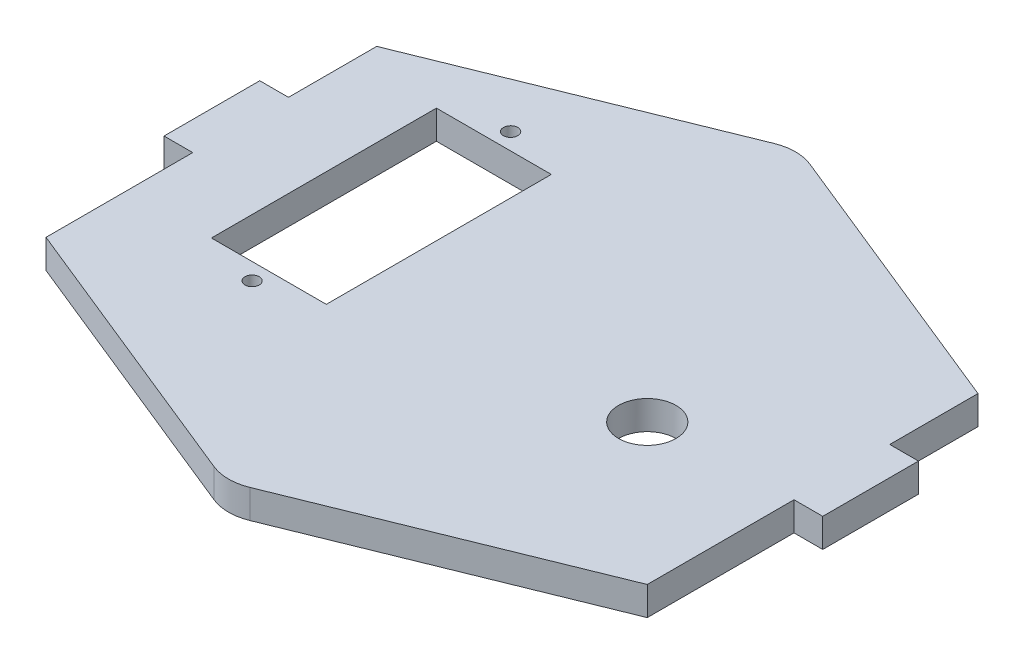
from build123d import *

# Parameters (mm, degrees)
BOSS_EXTRUDE4_DEPTH      = 3
SKETCH8_W                = 3
SKETCH8_H                = 8
SKETCH8_H_2              = 14.11
CUT_EXTRUDE5_DEPTH       = 3
SKETCH9_R                = 0.75
SKETCH9_W                = 12
SKETCH9_H                = 23.5
CUT_EXTRUDE6_DEPTH       = 3
FILLET2_R                = 5
SPLIT1_SURFACE_1_1_BACK  = 91.82
SPLIT1_SURFACE_1_1_DEPTH = 183.64
SPLIT1_SURFACE_1_2_BACK  = 91.82
SPLIT1_SURFACE_1_2_DEPTH = 183.64
SPLIT1_SURFACE_2_3_BACK  = 91.82
SPLIT1_SURFACE_2_3_DEPTH = 183.64
SPLIT1_SURFACE_2_4_BACK  = 91.82
SPLIT1_SURFACE_2_4_DEPTH = 183.64
SPLIT1_SURFACE_3_5_BACK  = 91.82
SPLIT1_SURFACE_3_5_DEPTH = 183.64
SPLIT1_SURFACE_3_6_BACK  = 91.82
SPLIT1_SURFACE_3_6_DEPTH = 183.64
SPLIT1_SURFACE_4_7_BACK  = 91.82
SPLIT1_SURFACE_4_7_DEPTH = 183.64
SPLIT1_SURFACE_4_8_BACK  = 91.82
SPLIT1_SURFACE_4_8_DEPTH = 183.64
SKETCH11_R               = 3
CUT_EXTRUDE7_DEPTH       = 10


with BuildPart() as part:
    # Sketch6 → Boss-Extrude4 (new body)
    with BuildSketch(Plane(origin=(0, 0, 0), x_dir=(1, 0, 0), z_dir=(0, 1, 0))):
        Polygon((-34.4, 16.055), (0, 30), (34.4, 16.055), (34.4, -16.055), (0, -30), (-34.4, -16.055), align=None)
    extrude(amount=BOSS_EXTRUDE4_DEPTH)

    # Sketch8 → Cut-Extrude5 (cut)
    with BuildSketch(Plane(origin=(0, 3, 0), x_dir=(1, 0, 0), z_dir=(0, 1, 0))):
        with Locations((32.9, 12.055)):
            Rectangle(SKETCH8_W, SKETCH8_H)
        with Locations((32.9, -9)):
            Rectangle(SKETCH8_W, SKETCH8_H_2)
        with Locations((-32.9, -9)):
            Rectangle(SKETCH8_W, SKETCH8_H_2)
        with Locations((-32.9, 12.055)):
            Rectangle(SKETCH8_W, SKETCH8_H)
    extrude(amount=-CUT_EXTRUDE5_DEPTH, mode=Mode.SUBTRACT)

    # Sketch9 → Cut-Extrude6 (cut)
    with BuildSketch(Plane(origin=(0, 3, 0), x_dir=(1, 0, 0), z_dir=(0, 1, 0))):
        with Locations(Location((-16.7, 16.555, 0), (0, 0, 270))):
            Circle(SKETCH9_R)
        with Locations(Location((-16.7, -10.445, 0), (0, 0, 90))):
            Circle(SKETCH9_R)
        with Locations((-16.7, 3.055)):
            Rectangle(SKETCH9_W, SKETCH9_H)
    extrude(amount=-CUT_EXTRUDE6_DEPTH, mode=Mode.SUBTRACT)

    # Fillet2
    fillet2_edges = [part.edges().sort_by_distance(p)[0] for p in [
        (0, 1.5, -30),
        (0, 1.5, 30),
    ]]
    fillet(fillet2_edges, radius=FILLET2_R)


with BuildPart() as body_2:
    # Split1: the piece behind the surface
    add(part.part)
    # Split1 surface 1: a surface, the sketch's curves swept straight by 183.64 mm
    with BuildLine(Plane(origin=(0, 3, 0), x_dir=(1, 0, 0), z_dir=(0, 1, 0)).offset(-SPLIT1_SURFACE_1_1_BACK), mode=Mode.PRIVATE) as split1_surface_1_1_path:
        Line((34.4, 16.055), (31.4, 16.055))
        Line((31.4, 16.055), (31.4, 17.271133721))
        Line((31.4, 17.271133721), (34.4, 16.055))
    split1_surface_1_1 = Shell.extrude(split1_surface_1_1_path.wire(), (0 * SPLIT1_SURFACE_1_1_DEPTH, 1 * SPLIT1_SURFACE_1_1_DEPTH, 0 * SPLIT1_SURFACE_1_1_DEPTH))
    split(bisect_by=split1_surface_1_1, keep=Keep.BOTTOM)


with BuildPart() as part_1:
    add(part.part)

    # Split1: split by a surface, the side it looks to stays
    # Split1 surface 1: a surface, the sketch's curves swept straight by 183.64 mm
    with BuildLine(Plane(origin=(0, 3, 0), x_dir=(1, 0, 0), z_dir=(0, 1, 0)).offset(-SPLIT1_SURFACE_1_2_BACK), mode=Mode.PRIVATE) as split1_surface_1_2_path:
        Line((34.4, 16.055), (31.4, 16.055))
        Line((31.4, 16.055), (31.4, 17.271133721))
        Line((31.4, 17.271133721), (34.4, 16.055))
    split1_surface_1_2 = Shell.extrude(split1_surface_1_2_path.wire(), (0 * SPLIT1_SURFACE_1_2_DEPTH, 1 * SPLIT1_SURFACE_1_2_DEPTH, 0 * SPLIT1_SURFACE_1_2_DEPTH))
    split(bisect_by=split1_surface_1_2, keep=Keep.TOP)


with BuildPart() as body_3:
    # Split1 2: the piece behind the surface
    add(part_1.part)
    # Split1 surface 2: a surface, the sketch's curves swept straight by 183.64 mm
    with BuildLine(Plane(origin=(0, 3, 0), x_dir=(1, 0, 0), z_dir=(0, 1, 0)).offset(-SPLIT1_SURFACE_2_3_BACK), mode=Mode.PRIVATE) as split1_surface_2_3_path:
        Line((31.4, -17.271133721), (31.4, -16.055))
        Line((31.4, -16.055), (34.4, -16.055))
        Line((34.4, -16.055), (31.4, -17.271133721))
    split1_surface_2_3 = Shell.extrude(split1_surface_2_3_path.wire(), (0 * SPLIT1_SURFACE_2_3_DEPTH, 1 * SPLIT1_SURFACE_2_3_DEPTH, 0 * SPLIT1_SURFACE_2_3_DEPTH))
    split(bisect_by=split1_surface_2_3, keep=Keep.BOTTOM)


with BuildPart() as part_2:
    add(part_1.part)

    # Split1 2: split by a surface, the side it looks to stays
    # Split1 surface 2: a surface, the sketch's curves swept straight by 183.64 mm
    with BuildLine(Plane(origin=(0, 3, 0), x_dir=(1, 0, 0), z_dir=(0, 1, 0)).offset(-SPLIT1_SURFACE_2_4_BACK), mode=Mode.PRIVATE) as split1_surface_2_4_path:
        Line((31.4, -17.271133721), (31.4, -16.055))
        Line((31.4, -16.055), (34.4, -16.055))
        Line((34.4, -16.055), (31.4, -17.271133721))
    split1_surface_2_4 = Shell.extrude(split1_surface_2_4_path.wire(), (0 * SPLIT1_SURFACE_2_4_DEPTH, 1 * SPLIT1_SURFACE_2_4_DEPTH, 0 * SPLIT1_SURFACE_2_4_DEPTH))
    split(bisect_by=split1_surface_2_4, keep=Keep.TOP)


with BuildPart() as body_4_2:
    # Split1 3: the piece behind the surface
    add(part_2.part)
    # Split1 surface 3: a surface, the sketch's curves swept straight by 183.64 mm
    with BuildLine(Plane(origin=(0, 3, 0), x_dir=(1, 0, 0), z_dir=(0, 1, 0)).offset(-SPLIT1_SURFACE_3_5_BACK), mode=Mode.PRIVATE) as split1_surface_3_5_path:
        Line((-31.4, -17.271133721), (-31.4, -16.055))
        Line((-31.4, -16.055), (-34.4, -16.055))
        Line((-34.4, -16.055), (-31.4, -17.271133721))
    split1_surface_3_5 = Shell.extrude(split1_surface_3_5_path.wire(), (0 * SPLIT1_SURFACE_3_5_DEPTH, 1 * SPLIT1_SURFACE_3_5_DEPTH, 0 * SPLIT1_SURFACE_3_5_DEPTH))
    split(bisect_by=split1_surface_3_5, keep=Keep.BOTTOM)


with BuildPart() as part_3:
    add(part_2.part)

    # Split1 3: split by a surface, the side it looks to stays
    # Split1 surface 3: a surface, the sketch's curves swept straight by 183.64 mm
    with BuildLine(Plane(origin=(0, 3, 0), x_dir=(1, 0, 0), z_dir=(0, 1, 0)).offset(-SPLIT1_SURFACE_3_6_BACK), mode=Mode.PRIVATE) as split1_surface_3_6_path:
        Line((-31.4, -17.271133721), (-31.4, -16.055))
        Line((-31.4, -16.055), (-34.4, -16.055))
        Line((-34.4, -16.055), (-31.4, -17.271133721))
    split1_surface_3_6 = Shell.extrude(split1_surface_3_6_path.wire(), (0 * SPLIT1_SURFACE_3_6_DEPTH, 1 * SPLIT1_SURFACE_3_6_DEPTH, 0 * SPLIT1_SURFACE_3_6_DEPTH))
    split(bisect_by=split1_surface_3_6, keep=Keep.TOP)


with BuildPart() as body_5_2:
    # Split1 4 body 4 2: the piece behind the surface
    add(body_4_2.part)
    # Split1 surface 4: a surface, the sketch's curves swept straight by 183.64 mm
    with BuildLine(Plane(origin=(0, 3, 0), x_dir=(1, 0, 0), z_dir=(0, 1, 0)).offset(-SPLIT1_SURFACE_4_7_BACK), mode=Mode.PRIVATE) as split1_surface_4_7_path:
        Line((-34.4, 16.055), (-31.4, 16.055))
        Line((-31.4, 16.055), (-31.4, 17.271133721))
        Line((-31.4, 17.271133721), (-34.4, 16.055))
    split1_surface_4_7 = Shell.extrude(split1_surface_4_7_path.wire(), (0 * SPLIT1_SURFACE_4_7_DEPTH, 1 * SPLIT1_SURFACE_4_7_DEPTH, 0 * SPLIT1_SURFACE_4_7_DEPTH))
    split(bisect_by=split1_surface_4_7, keep=Keep.BOTTOM)


with BuildPart() as body_4_2_1:
    add(body_4_2.part)

    # Split1 4 body 4 2: split by a surface, the side it looks to stays
    # Split1 surface 4: a surface, the sketch's curves swept straight by 183.64 mm
    with BuildLine(Plane(origin=(0, 3, 0), x_dir=(1, 0, 0), z_dir=(0, 1, 0)).offset(-SPLIT1_SURFACE_4_8_BACK), mode=Mode.PRIVATE) as split1_surface_4_8_path:
        Line((-34.4, 16.055), (-31.4, 16.055))
        Line((-31.4, 16.055), (-31.4, 17.271133721))
        Line((-31.4, 17.271133721), (-34.4, 16.055))
    split1_surface_4_8 = Shell.extrude(split1_surface_4_8_path.wire(), (0 * SPLIT1_SURFACE_4_8_DEPTH, 1 * SPLIT1_SURFACE_4_8_DEPTH, 0 * SPLIT1_SURFACE_4_8_DEPTH))
    split(bisect_by=split1_surface_4_8, keep=Keep.TOP)

    # Sketch11 → Cut-Extrude7 (cut)
    with BuildSketch(Plane(origin=(0, 3, 0), x_dir=(1, 0, 0), z_dir=(0, 1, 0))):
        with Locations(Location((16.7, -2.571133721, 0), (0, 0, 270))):
            Circle(SKETCH11_R)
    extrude(amount=-CUT_EXTRUDE7_DEPTH, mode=Mode.SUBTRACT)


solid = body_4_2_1.part
